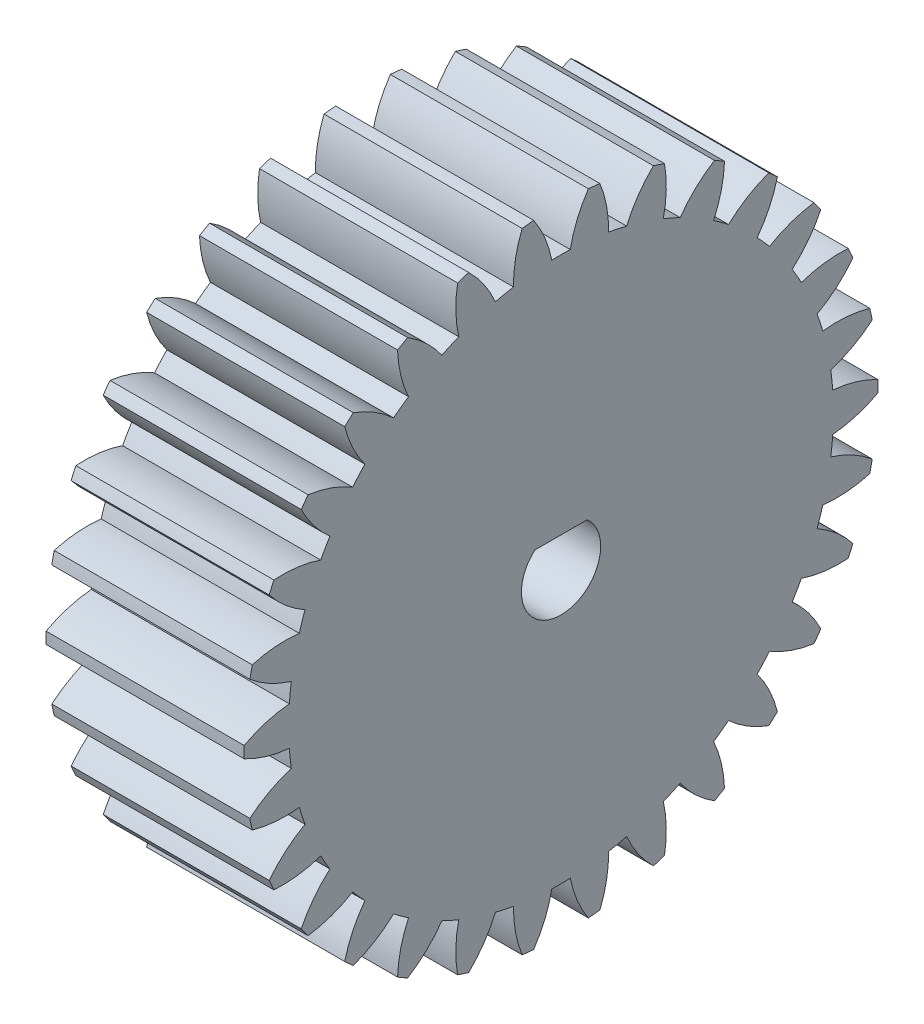
from build123d import *

# Parameters (mm, degrees)
BASPROSKE_W        = 10
BASPROSKE_H        = 16
TOOTHCUT_DEPTH     = 25.738633754
TEETHCUTS_COUNT    = 30
TEETHCUTS_ANGLE    = 348
BORSKE_R           = 0.4
BORE_DEPTH         = 50.0000508
CUT_EXTRUDE1_DEPTH = 25.700050474


with BuildPart() as part:
    # BasProSke → Base-Revolve (revolve)
    with BuildSketch(Plane(origin=(0, 0, 0), x_dir=(1, 0, 0), z_dir=(0, 1, 0)), mode=Mode.PRIVATE) as base_revolve_sk:
        with Locations((5, 8)):
            Rectangle(BASPROSKE_W, BASPROSKE_H)
    revolve(base_revolve_sk.sketch.rotate(Axis((-10, 0, 0), (1, 0, 0)), 180), axis=Axis((-10, 0, 0), (1, 0, 0)))

    # TooCutSke → ToothCut (cut, through all)
    with BuildSketch(Plane(origin=(0, 0, 0), x_dir=(0, 0, -1), z_dir=(1, 0, 0))):
        with BuildLine():
            ThreePointArc((0.466400716, 13.741086979), (0, 13.749), (-0.466400716, 13.741086979))
            ThreePointArc((-0.466400716, 13.741086979), (-0.819142092, 14.899954875), (-1.3974676, 15.964351834))
            ThreePointArc((-1.3974676, 15.964351834), (0, 16.0254), (1.3974676, 15.964351834))
            ThreePointArc((1.3974676, 15.964351834), (0.819142092, 14.899954875), (0.466400716, 13.741086979))
        make_face()
    toothcut = extrude(amount=TOOTHCUT_DEPTH, mode=Mode.SUBTRACT)

    # TeethCuts: ToothCut ×30 about axis
    teethcuts_axis = Axis((-10, 0, 0), (1, 0, 0))
    for i in range(1, TEETHCUTS_COUNT):
        add(toothcut.rotate(teethcuts_axis, i * TEETHCUTS_ANGLE / (TEETHCUTS_COUNT - 1)), mode=Mode.SUBTRACT)

    # BorSke → Bore (cut, symmetric)
    with BuildSketch(Plane(origin=(0, 0, 0), x_dir=(0, 0, -1), z_dir=(1, 0, 0))):
        with Locations(Location((0, 0, 0), (0, 0, 180))):
            Circle(BORSKE_R)
    extrude(amount=BORE_DEPTH, both=True, mode=Mode.SUBTRACT)

    # Sketch1 → Cut-Extrude1 (cut, through all)
    with BuildSketch(Plane(origin=(10, 0, 0), x_dir=(0, 0, -1), z_dir=(1, 0, 0))):
        with BuildLine():
            Line((-1.322875656, 1.5), (1.322875656, 1.5))
            ThreePointArc((1.322875656, 1.5), (0, -2), (-1.322875656, 1.5))
        make_face()
    extrude(amount=-CUT_EXTRUDE1_DEPTH, mode=Mode.SUBTRACT)


solid = part.part
